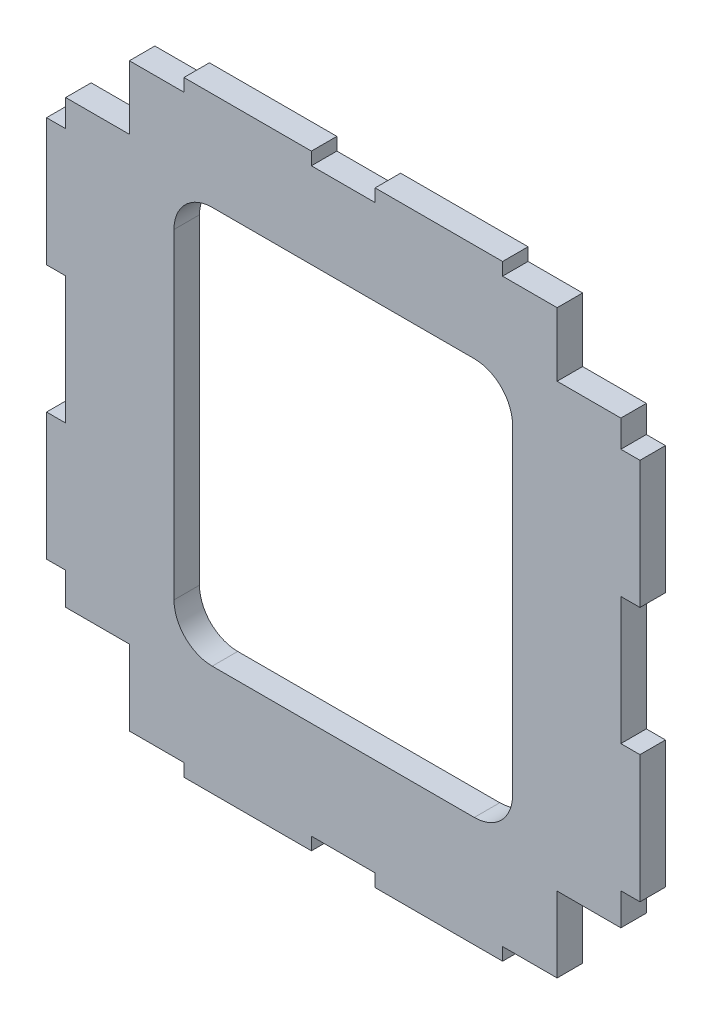
from build123d import *

# Parameters (mm, degrees)
EXTRUDE_1_DEPTH = 2


with BuildPart() as part:
    # Model → 凸台-拉伸1 (new body)
    with BuildSketch(Plane.XY):
        Polygon((29.994704425, 53.063306025), (34.274704425, 53.063306025), (34.274704425, 54.063661731), (44.274704425, 54.063661731), (44.274704425, 53.063306025), (49.274704425, 53.063306025), (49.274704425, 54.063661731), (59.274704425, 54.063661731), (59.274704425, 53.063306025), (63.554704425, 53.063306025), (63.554704425, 48.063306025), (68.554704425, 48.063306025), (68.554704425, 45.943306025), (70.054704425, 45.943306025), (70.054704425, 35.943306025), (68.554704425, 35.943306025), (68.554704425, 25.943306025), (70.054704425, 25.943306025), (70.054704425, 15.943306025), (68.554704425, 15.943306025), (68.554704425, 13.423306025), (63.554704425, 13.423306025), (63.554704425, 7.516414838), (59.274704425, 7.516414838), (59.274704425, 6.516059132), (49.274704425, 6.516059132), (49.274704425, 7.516414838), (44.274704425, 7.516414838), (44.274704425, 6.516059132), (34.274704425, 6.516059132), (34.274704425, 7.516414838), (29.994704425, 7.516414838), (29.994704425, 13.423306025), (24.994704425, 13.423306025), (24.994704425, 15.943306025), (23.494704425, 15.943306025), (23.494704425, 25.943306025), (24.994704425, 25.943306025), (24.994704425, 35.943306025), (23.494704425, 35.943306025), (23.494704425, 45.943306025), (24.994704425, 45.943306025), (24.994704425, 48.063306025), (29.994704425, 48.063306025), align=None)
        with BuildLine():
            Line((57.054704425, 46.346244952), (36.494704425, 46.346244952))
            ThreePointArc((36.494704425, 46.346244952), (34.373384082, 45.467565295), (33.494704425, 43.346244952))
            Line((33.494704425, 43.346244952), (33.494704425, 18.176244952))
            ThreePointArc((33.494704425, 18.176244952), (34.373384082, 16.054924608), (36.494704425, 15.176244952))
            Line((36.494704425, 15.176244952), (57.054704425, 15.176244952))
            ThreePointArc((57.054704425, 15.176244952), (59.176024769, 16.054924608), (60.054704425, 18.176244952))
            Line((60.054704425, 18.176244952), (60.054704425, 43.346244952))
            ThreePointArc((60.054704425, 43.346244952), (59.176024769, 45.467565295), (57.054704425, 46.346244952))
        make_face(mode=Mode.SUBTRACT)
    extrude(amount=EXTRUDE_1_DEPTH)


solid = part.part
